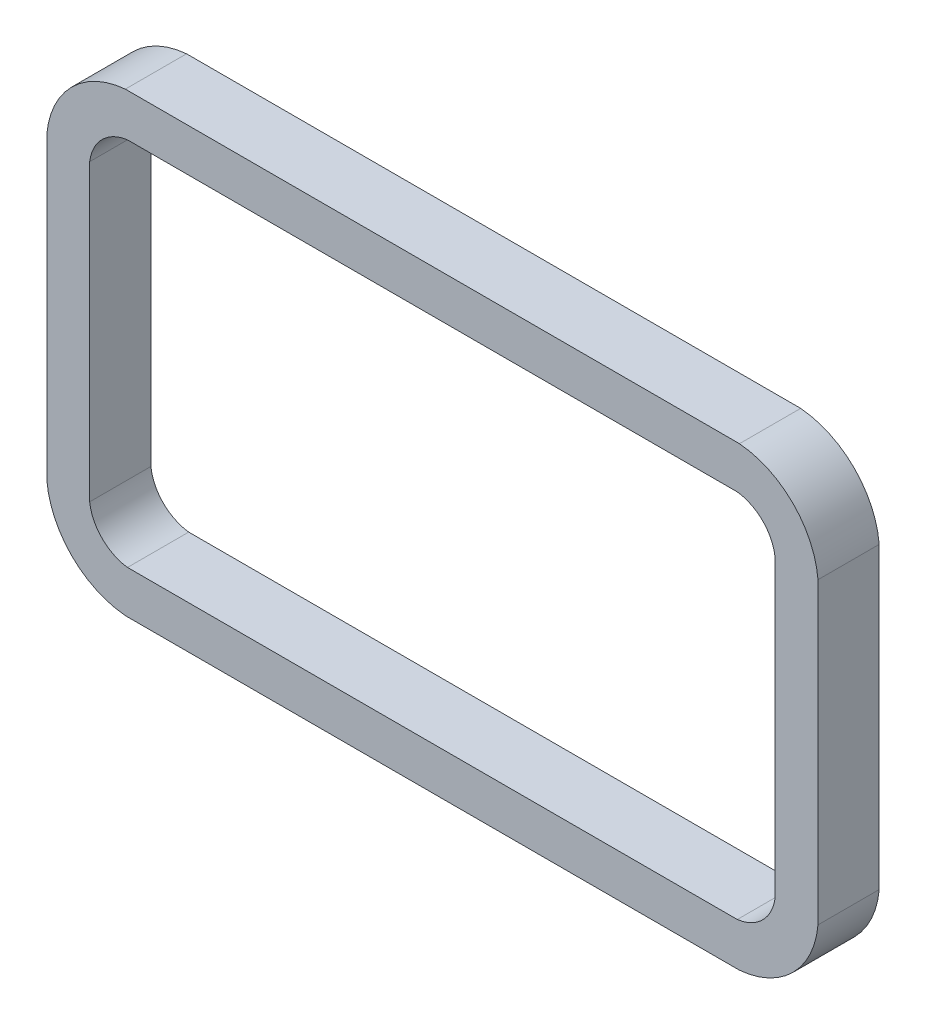
from build123d import *

# Parameters (mm, degrees)
EXTRUDE_1_DEPTH = 10


with BuildPart() as part:
    # Эскиз1 → Бобышка-Вытянуть1 (new body)
    with BuildSketch(Plane.XY):
        with BuildLine():
            Line((63, -24.419804811), (63, 24.419804811))
            ThreePointArc((63, 24.419804811), (58.922335459, 33.172335459), (50.169804811, 37.25))
            Line((50.169804811, 37.25), (-50.169804811, 37.25))
            ThreePointArc((-50.169804811, 37.25), (-58.922335459, 33.172335459), (-63, 24.419804811))
            Line((-63, 24.419804811), (-63, -24.419804811))
            ThreePointArc((-63, -24.419804811), (-58.922335459, -33.172335459), (-50.169804811, -37.25))
            Line((-50.169804811, -37.25), (50.169804811, -37.25))
            ThreePointArc((50.169804811, -37.25), (58.922335459, -33.172335459), (63, -24.419804811))
        make_face()
        with BuildLine():
            Line((56, -24.064996098), (56, 24.064996098))
            ThreePointArc((56, 24.064996098), (53.97258799, 28.22258799), (49.814996098, 30.25))
            Line((49.814996098, 30.25), (-49.814996098, 30.25))
            ThreePointArc((-49.814996098, 30.25), (-53.97258799, 28.22258799), (-56, 24.064996098))
            Line((-56, 24.064996098), (-56, -24.064996098))
            ThreePointArc((-56, -24.064996098), (-53.97258799, -28.22258799), (-49.814996098, -30.25))
            Line((-49.814996098, -30.25), (49.814996098, -30.25))
            ThreePointArc((49.814996098, -30.25), (53.97258799, -28.22258799), (56, -24.064996098))
        make_face(mode=Mode.SUBTRACT)
    extrude(amount=EXTRUDE_1_DEPTH)


solid = part.part
